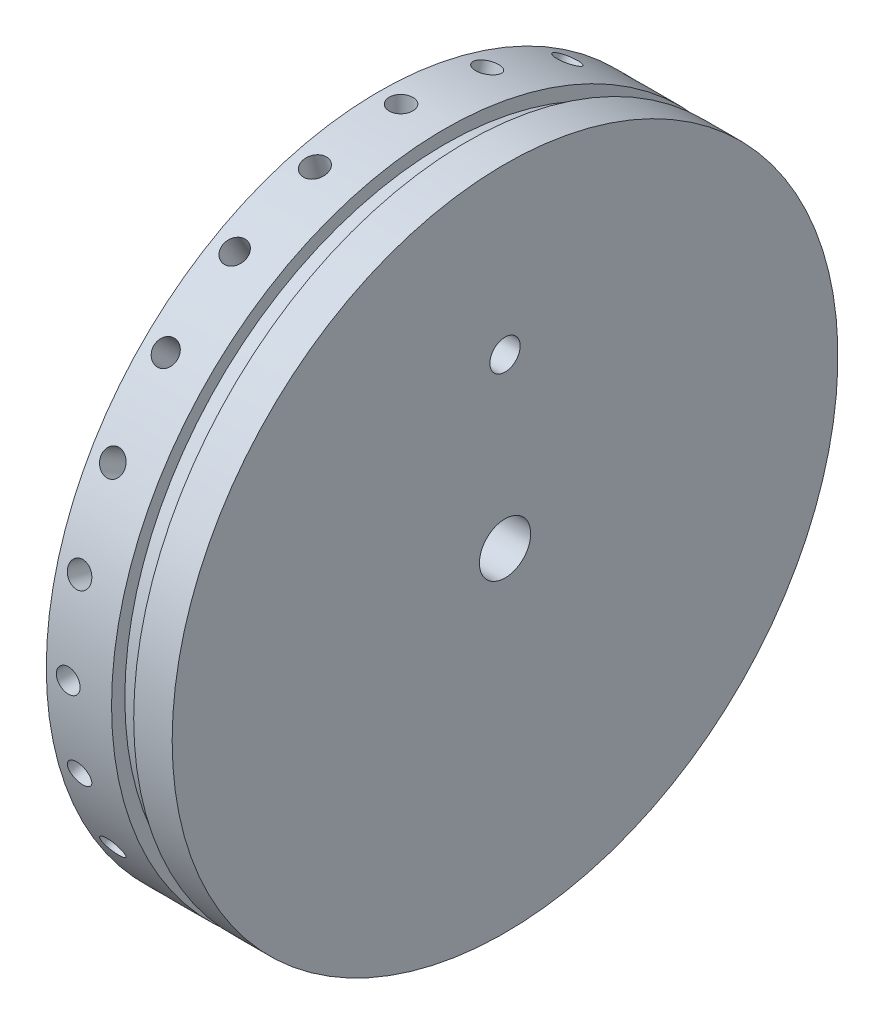
from build123d import *

# Parameters (mm, degrees)
OUTLET_PORT_THREAD_BORE_SKETCH_R = 8.73
OUTLET_PORT_THREAD_BORE_DEPTH    = 14.3
OUTLET_PORT_PASSAGE_SKETCH_R     = 5.5
OUTLET_PORT_PASSAGE_DEPTH        = 12.7
FILL_PORT_THREAD_BORE_SKETCH_R   = 4.953
FILL_PORT_THREAD_BORE_DEPTH      = 10.5
FILL_PORT_PASSAGE_SKETCH_R       = 3.25
FILL_PORT_PASSAGE_DEPTH          = 11.5
SCREW_HOLE_SKETCH_W              = 2.55
SCREW_HOLE_SKETCH_H              = 11.5
SCREW_HOLES_X24_COUNT            = 24


with BuildPart() as part:
    # Cap Body Sketch → Cap Body (revolve)
    with BuildSketch(Plane.XY):
        Polygon((8, 0), (8, 15.2), (13, 15.2), (13, 58), (8, 58), (8, 71.4), (22, 71.4), (22, 68.555), (26.75, 68.555), (26.75, 71.4), (35, 71.4), (35, 0), align=None)
    revolve(axis=Axis((-1000, 0, 0), (1, 0, 0)))

    # Outlet Port Thread Bore Sketch → Outlet Port Thread Bore (cut)
    with BuildSketch(Plane(origin=(8, 0, 0), x_dir=(0, 0, -1), z_dir=(1, 0, 0))):
        Circle(OUTLET_PORT_THREAD_BORE_SKETCH_R)
    extrude(amount=OUTLET_PORT_THREAD_BORE_DEPTH, mode=Mode.SUBTRACT)

    # Outlet Port Passage Sketch → Outlet Port Passage (cut)
    with BuildSketch(Plane(origin=(22.3, 0, 0), x_dir=(0, 0, -1), z_dir=(1, 0, 0))):
        Circle(OUTLET_PORT_PASSAGE_SKETCH_R)
    extrude(amount=OUTLET_PORT_PASSAGE_DEPTH, mode=Mode.SUBTRACT)

    # Fill Port Thread Bore Sketch → Fill Port Thread Bore (cut)
    with BuildSketch(Plane(origin=(13, 0, 0), x_dir=(0, 0, -1), z_dir=(1, 0, 0))):
        with Locations((0, 36)):
            Circle(FILL_PORT_THREAD_BORE_SKETCH_R)
    extrude(amount=FILL_PORT_THREAD_BORE_DEPTH, mode=Mode.SUBTRACT)

    # Fill Port Passage Sketch → Fill Port Passage (cut)
    with BuildSketch(Plane(origin=(23.5, 0, 0), x_dir=(0, 0, -1), z_dir=(1, 0, 0))):
        with Locations((0, 36)):
            Circle(FILL_PORT_PASSAGE_SKETCH_R)
    extrude(amount=FILL_PORT_PASSAGE_DEPTH, mode=Mode.SUBTRACT)

    # Screw Hole Sketch → Screw Hole (revolve, cut)
    with BuildSketch(Plane.XY):
        with Locations((13.975, 66.65)):
            Rectangle(SCREW_HOLE_SKETCH_W, SCREW_HOLE_SKETCH_H)
    screw_hole = revolve(axis=Axis((12.7, 51.4, 0), (0, 1, 0)), mode=Mode.SUBTRACT)

    # Screw Holes x24: Screw Hole ×24 about axis
    screw_holes_x24_axis = Axis((36.35, 0, 0), (-1, 0, 0))
    for i in range(1, SCREW_HOLES_X24_COUNT):
        add(screw_hole.rotate(screw_holes_x24_axis, i * 360 / SCREW_HOLES_X24_COUNT), mode=Mode.SUBTRACT)


solid = part.part
